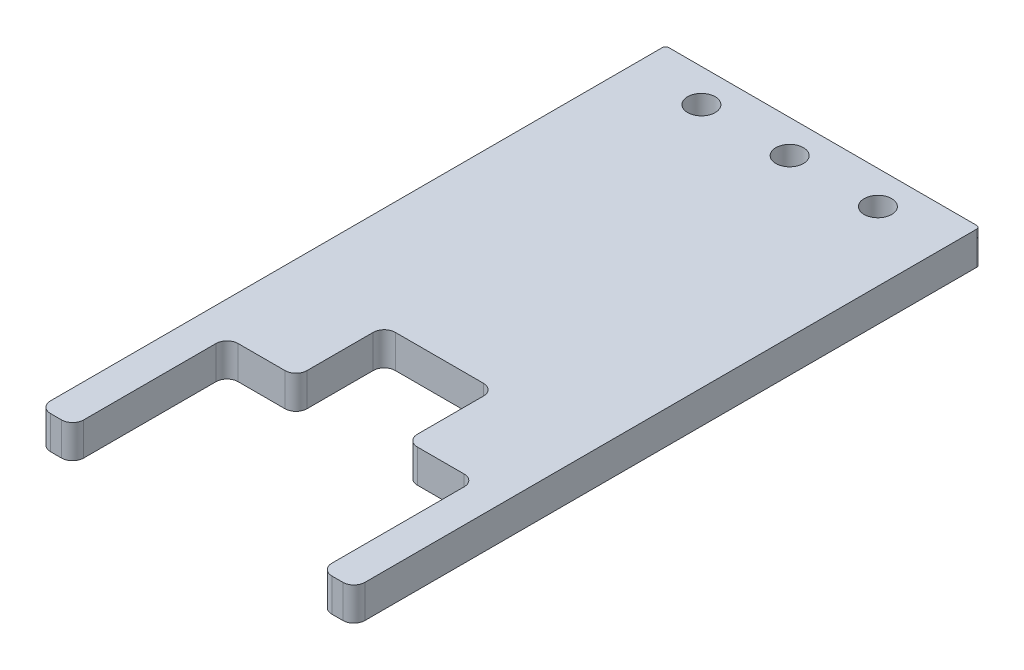
from build123d import *

# Parameters (mm, degrees)
SKETCH1_W             = 28.5
SKETCH1_H             = 42.75
BOSS_EXTRUDE1_DEPTH   = 3
M3X0_5_TAPPED_HOLE1_D = 2.5
SKETCH6_W             = 3
SKETCH6_H             = 14
BOSS_EXTRUDE2_DEPTH   = 3
SKETCH7_W             = 10
SKETCH7_H             = 8
CUT_EXTRUDE1_DEPTH    = 52.466615393
FILLET1_R             = 1
FILLET2_R             = 0.3


with BuildPart() as part:
    # Sketch1 → Boss-Extrude1 (new body)
    with BuildSketch(Plane(origin=(0, 0, 0), x_dir=(1, 0, 0), z_dir=(0, 1, 0))):
        with Locations((14.25, 21.375)):
            Rectangle(SKETCH1_W, SKETCH1_H)
    extrude(amount=BOSS_EXTRUDE1_DEPTH)

    # M3x0.5 Tapped Hole1 (through all)
    with Locations(Plane(origin=(0, 0, 0), x_dir=(-1, 0, 0), z_dir=(0, -1, 0))):
        with Locations((-22.25, 39.75), (-14.25, 39.75), (-6.25, 39.75)):
            Hole(M3X0_5_TAPPED_HOLE1_D / 2)

    # Sketch6 → Boss-Extrude2 (add)
    with BuildSketch(Plane(origin=(0, 3, 0), x_dir=(1, 0, 0), z_dir=(0, 1, 0))):
        with Locations((1.5, -7)):
            Rectangle(SKETCH6_W, SKETCH6_H)
        with Locations((27, -7)):
            Rectangle(SKETCH6_W, SKETCH6_H)
    extrude(amount=-BOSS_EXTRUDE2_DEPTH)

    # Sketch7 → Cut-Extrude1 (cut, through all)
    with BuildSketch(Plane(origin=(0, 3, 0), x_dir=(1, 0, 0), z_dir=(0, 1, 0))):
        with Locations((14.25, 4)):
            Rectangle(SKETCH7_W, SKETCH7_H)
    extrude(amount=-CUT_EXTRUDE1_DEPTH, mode=Mode.SUBTRACT)

    # Fillet1
    fillet1_edges = [part.edges().sort_by_distance(p)[0] for p in [
        (3, 1.5, 0),
        (3, 1.5, 14),
        (0, 1.5, 14),
        (25.5, 1.5, 14),
        (25.5, 1.5, 0),
        (28.5, 1.5, 14),
        (19.25, 1.5, -8),
        (19.25, 1.5, 0),
        (9.25, 1.5, 0),
        (9.25, 1.5, -8),
    ]]
    fillet(fillet1_edges, radius=FILLET1_R)

    # Fillet2
    fillet2_edges = [part.edges().sort_by_distance(p)[0] for p in [
        (0, 1.5, -42.75),
        (28.5, 1.5, -42.75),
    ]]
    fillet(fillet2_edges, radius=FILLET2_R)


solid = part.part
